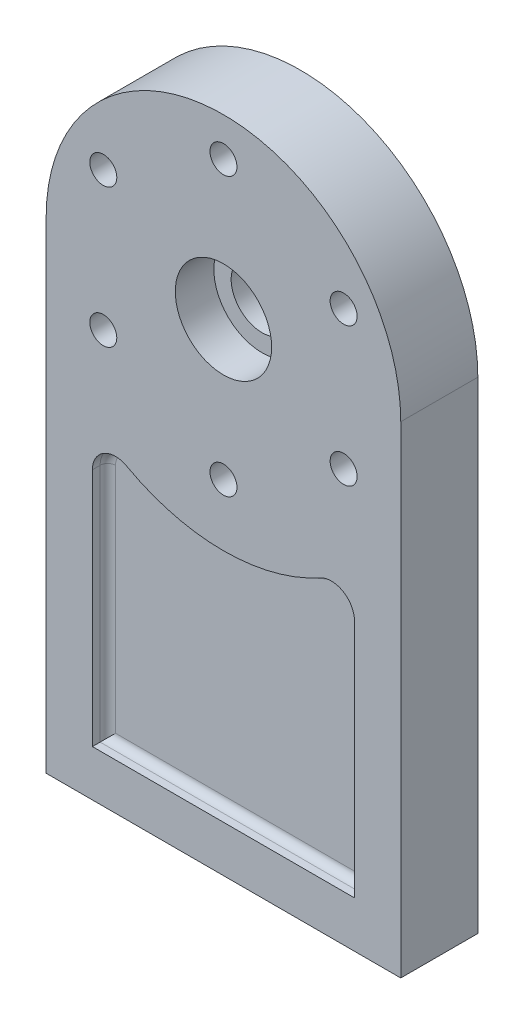
from build123d import *

# Parameters (mm, degrees)
SKETCH1_R                               = 8
BOSS_EXTRUDE1_DEPTH                     = 10
SKETCH2_R                               = 12.5
CUT_EXTRUDE1_DEPTH                      = 10
SKETCH3_R                               = 3.5
CUT_EXTRUDE2_DEPTH                      = 40
SKETCH4_R                               = 6
CUT_EXTRUDE3_DEPTH                      = 6
CIRPATTERN1_COUNT                       = 6
TAP_DRILL_FOR_M10X1_25_TAP1_D           = 8.8
TAP_DRILL_FOR_M10X1_25_TAP1_DEPTH       = 24
TAP_DRILL_FOR_M10X1_25_TAP1_CSINK_D     = 8.85
TAP_DRILL_FOR_M10X1_25_TAP1_CSINK_ANGLE = 90
TAP_DRILL_FOR_M10X1_25_TAP1_TIP         = 2.643786724
CUT_EXTRUDE4_DEPTH                      = 4
FILLET2_R                               = 2
FILLET2_OF_MIRROR5_R                    = 2


with BuildPart() as part:
    # Sketch1 → Boss-Extrude1 (new, symmetric)
    with BuildSketch(Plane.XY):
        with BuildLine():
            Line((-46.348133122, 124.999515212), (-46.348133122, 0))
            Line((-46.348133122, 0), (45.651866878, 0))
            Line((45.651866878, 0), (45.651866878, 124.999515212))
            ThreePointArc((45.651866878, 124.999515212), (-0.348133122, 170.999515212), (-46.348133122, 124.999515212))
        make_face()
        with Locations((-0.348133122, 124.999515212)):
            Circle(SKETCH1_R, mode=Mode.SUBTRACT)
    extrude(amount=BOSS_EXTRUDE1_DEPTH, both=True)

    # Sketch2 → Cut-Extrude1 (cut)
    with BuildSketch(Plane.XY.offset(10)):
        with Locations((-0.348133122, 124.999515212)):
            Circle(SKETCH2_R)
    extrude(amount=-CUT_EXTRUDE1_DEPTH, mode=Mode.SUBTRACT)

    # Sketch3 → Cut-Extrude2 (cut)
    with BuildSketch(Plane.XY.offset(10)):
        with Locations((-0.348133122, 160.999515212)):
            Circle(SKETCH3_R)
    cut_extrude2 = extrude(amount=-CUT_EXTRUDE2_DEPTH, mode=Mode.SUBTRACT)

    # Sketch4 → Cut-Extrude3 (cut)
    with BuildSketch(Plane(origin=(0, 0, -10), x_dir=(-1, 0, 0), z_dir=(0, 0, -1))):
        with Locations((0.348133122, 160.999515212)):
            Circle(SKETCH4_R)
    cut_extrude3 = extrude(amount=-CUT_EXTRUDE3_DEPTH, mode=Mode.SUBTRACT)

    # CirPattern1: Cut-Extrude2, Cut-Extrude3 ×6 about axis
    cirpattern1_axis = Axis((-0.348133122, 124.999515212, 0), (0, 0, 1))
    add([cut_extrude2.rotate(cirpattern1_axis, i * 360 / CIRPATTERN1_COUNT) for i in range(1, CIRPATTERN1_COUNT)], mode=Mode.SUBTRACT)
    add([cut_extrude3.rotate(cirpattern1_axis, i * 360 / CIRPATTERN1_COUNT) for i in range(1, CIRPATTERN1_COUNT)], mode=Mode.SUBTRACT)

    # Tap Drill for M10x1.25 Tap1
    with Locations(Plane(origin=(0, 0, 0), x_dir=(-1, 0, 0), z_dir=(0, -1, 0))):
        with Locations((-29.651866878, 0), (30.348133122, 0)):
            CounterSinkHole(TAP_DRILL_FOR_M10X1_25_TAP1_D / 2, TAP_DRILL_FOR_M10X1_25_TAP1_CSINK_D / 2, depth=TAP_DRILL_FOR_M10X1_25_TAP1_DEPTH, counter_sink_angle=TAP_DRILL_FOR_M10X1_25_TAP1_CSINK_ANGLE)
            with Locations((0, 0, -(TAP_DRILL_FOR_M10X1_25_TAP1_DEPTH + TAP_DRILL_FOR_M10X1_25_TAP1_TIP / 2))):  # 118° drill point
                Cone(0, TAP_DRILL_FOR_M10X1_25_TAP1_D / 2, TAP_DRILL_FOR_M10X1_25_TAP1_TIP, mode=Mode.SUBTRACT)

    # Sketch15 → Cut-Extrude4 (cut)
    with BuildSketch(Plane.XY.offset(10)):
        with BuildLine():
            Line((33.651866878, 12), (33.651866878, 74.205814816))
            ThreePointArc((33.651866878, 74.205814816), (30.703152645, 79.372017984), (24.755315154, 79.460335546))
            ThreePointArc((24.755315154, 79.460335546), (-0.348133122, 72.999515212), (-25.451581398, 79.460335546))
            ThreePointArc((-25.451581398, 79.460335546), (-31.399418888, 79.372017984), (-34.348133122, 74.205814816))
            Line((-34.348133122, 74.205814816), (-34.348133122, 12))
            Line((-34.348133122, 12), (33.651866878, 12))
        make_face()
    cut_extrude4 = extrude(amount=-CUT_EXTRUDE4_DEPTH, mode=Mode.SUBTRACT)

    # Fillet2
    fillet2_edges = [part.edges().sort_by_distance(p)[0] for p in [
        (30.703152645, 79.372017984, 6),
        (33.651866878, 43.102907408, 6),
        (-0.348133122, 12, 6),
        (-34.348133122, 43.102907408, 6),
        (-31.399418888, 79.372017984, 6),
        (-0.348133122, 72.999515212, 6),
    ]]
    fillet(fillet2_edges, radius=FILLET2_R)

    # Mirror5: Cut-Extrude4 across plane
    add(cut_extrude4.mirror(Plane.XY), mode=Mode.SUBTRACT)

    # Fillet2 of Mirror5
    fillet2_of_mirror5_edges = [part.edges().sort_by_distance(p)[0] for p in [
        (30.703152645, 79.372017984, -6),
        (33.651866878, 43.102907408, -6),
        (-0.348133122, 12, -6),
        (-34.348133122, 43.102907408, -6),
        (-31.399418888, 79.372017984, -6),
        (-0.348133122, 72.999515212, -6),
    ]]
    fillet(fillet2_of_mirror5_edges, radius=FILLET2_OF_MIRROR5_R)


solid = part.part
